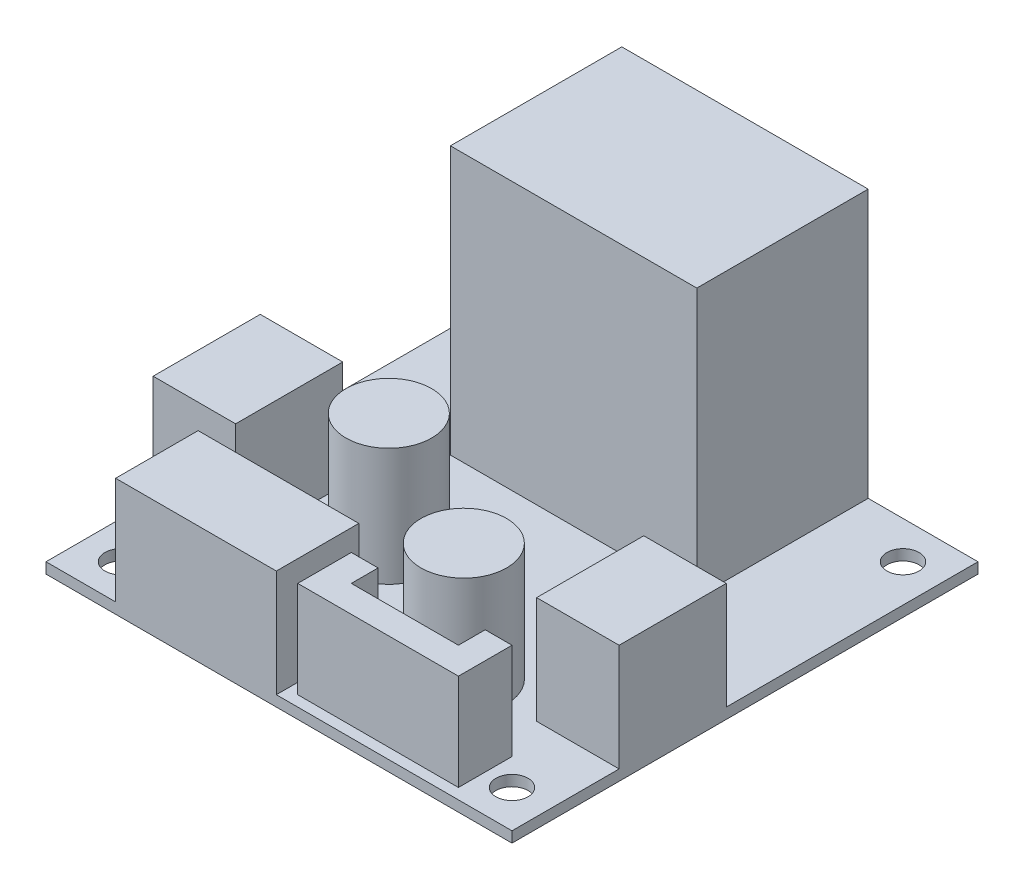
from build123d import *

# Parameters (mm, degrees)
SKETCH_1_W          = 43.5
SKETCH_1_H          = 43.5
EXTRUDE_1_DEPTH     = 1
SKETCH_2_R          = 1.5
CUT_EXTRUDE_1_DEPTH = 31.775396017
SKETCH_2_3_W        = 23
SKETCH_2_3_H        = 16
EXTRUDE_2_DEPTH     = 25
SKETCH_2_4_W        = 7.7
SKETCH_2_4_H        = 10
SKETCH_2_4_W_2      = 15
SKETCH_2_4_H_2      = 7.7
EXTRUDE_3_DEPTH     = 10
EXTRUDE_4_DEPTH     = 9
SKETCH_2_6_R        = 4
EXTRUDE_5_DEPTH     = 11


with BuildPart() as part:
    # Эскиз1 → Бобышка-Вытянуть1 (new body)
    with BuildSketch(Plane(origin=(0, 0, 0), x_dir=(1, 0, 0), z_dir=(0, 1, 0))):
        Rectangle(SKETCH_1_W, SKETCH_1_H)
    extrude(amount=EXTRUDE_1_DEPTH)

    # Эскиз2 → Вырез-Вытянуть1 (cut, through all)
    with BuildSketch(Plane(origin=(0, 1, 0), x_dir=(1, 0, 0), z_dir=(0, 1, 0))):
        with Locations((18.25, 18.25)):
            Circle(SKETCH_2_R)
        with Locations((-18.25, 18.25)):
            Circle(SKETCH_2_R)
        with Locations((-18.25, -18.25)):
            Circle(SKETCH_2_R)
        with Locations((18.25, -18.25)):
            Circle(SKETCH_2_R)
    extrude(amount=-CUT_EXTRUDE_1_DEPTH, mode=Mode.SUBTRACT)

    # Эскиз2<3> → Бобышка-Вытянуть2 (add)
    with BuildSketch(Plane(origin=(0, 1, 0), x_dir=(1, 0, 0), z_dir=(0, 1, 0))):
        with Locations((0, 13.75)):
            Rectangle(SKETCH_2_3_W, SKETCH_2_3_H)
    extrude(amount=EXTRUDE_2_DEPTH)

    # Эскиз2<4> → Бобышка-Вытянуть3 (add)
    with BuildSketch(Plane(origin=(0, 1, 0), x_dir=(1, 0, 0), z_dir=(0, 1, 0))):
        with Locations((17.9, -6.75)):
            Rectangle(SKETCH_2_4_W, SKETCH_2_4_H)
        with Locations((-7.75, -17.9)):
            Rectangle(SKETCH_2_4_W_2, SKETCH_2_4_H_2)
        with Locations((-17.9, -6.75)):
            Rectangle(SKETCH_2_4_W, SKETCH_2_4_H)
    extrude(amount=EXTRUDE_3_DEPTH)

    # Эскиз2<5> → Бобышка-Вытянуть4 (add)
    with BuildSketch(Plane(origin=(0, 1, 0), x_dir=(1, 0, 0), z_dir=(0, 1, 0))):
        Polygon((0.75, -15.75), (0.75, -20.75), (15.75, -20.75), (15.75, -15.75), (13.25, -15.75), (13.25, -18.25), (3.25, -18.25), (3.25, -15.75), align=None)
    extrude(amount=EXTRUDE_4_DEPTH)

    # Эскиз2<6> → Бобышка-Вытянуть5 (add)
    with BuildSketch(Plane(origin=(0, 1, 0), x_dir=(1, 0, 0), z_dir=(0, 1, 0))):
        with Locations((7.25, -11.75)):
            Circle(SKETCH_2_6_R)
        with Locations((-6.75, -4.75)):
            Circle(SKETCH_2_6_R)
    extrude(amount=EXTRUDE_5_DEPTH)


solid = part.part
